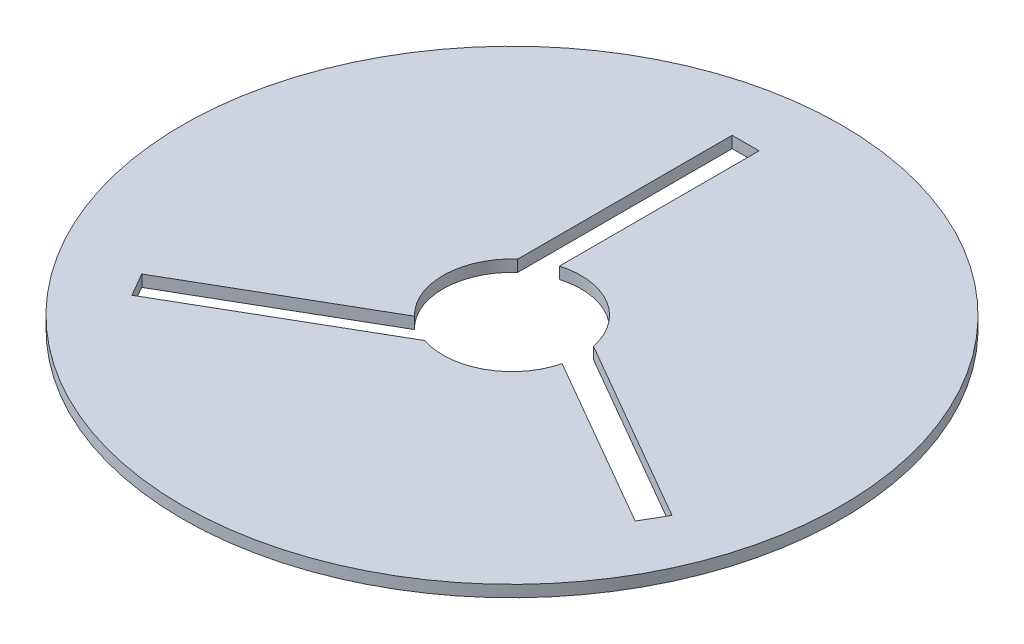
from build123d import *

# Parameters (mm, degrees)
CROQUIS3_R              = 85
SALIENTE_EXTRUIR1_DEPTH = 3


with BuildPart() as part:
    # Croquis3 → Saliente-Extruir1 (new body)
    with BuildSketch(Plane(origin=(0, 0, 0), x_dir=(1, 0, 0), z_dir=(0, 1, 0))):
        with Locations(Location((0, 0, 0), (0, 0, 270))):
            Circle(CROQUIS3_R)
        with BuildLine():
            Line((-4.87398, 68.6), (-4.87398, 17.119705575))
            ThreePointArc((-4.87398, 17.119705575), (9.231788563, 15.218872492), (17.434798803, 3.587170289))
            Line((17.434798803, 3.587170289), (65.3213327, -24.060132946))
            Line((65.3213327, -24.060132946), (61.8463327, -30.079009502))
            Line((61.8463327, -30.079009502), (17.263089933, -4.33886229))
            ThreePointArc((17.263089933, -4.33886229), (8.564035914, -15.604399664), (-5.610818803, -16.892563818))
            Line((-5.610818803, -16.892563818), (-53.4973527, -44.539867054))
            Line((-53.4973527, -44.539867054), (-56.9723527, -38.520990498))
            Line((-56.9723527, -38.520990498), (-12.389109933, -12.780843285))
            ThreePointArc((-12.389109933, -12.780843285), (-17.795824477, 0.385527171), (-11.82398, 13.305393529))
            Line((-11.82398, 13.305393529), (-11.82398, 68.6))
            Line((-11.82398, 68.6), (-4.87398, 68.6))
        make_face(mode=Mode.SUBTRACT)
    extrude(amount=SALIENTE_EXTRUIR1_DEPTH)


solid = part.part
